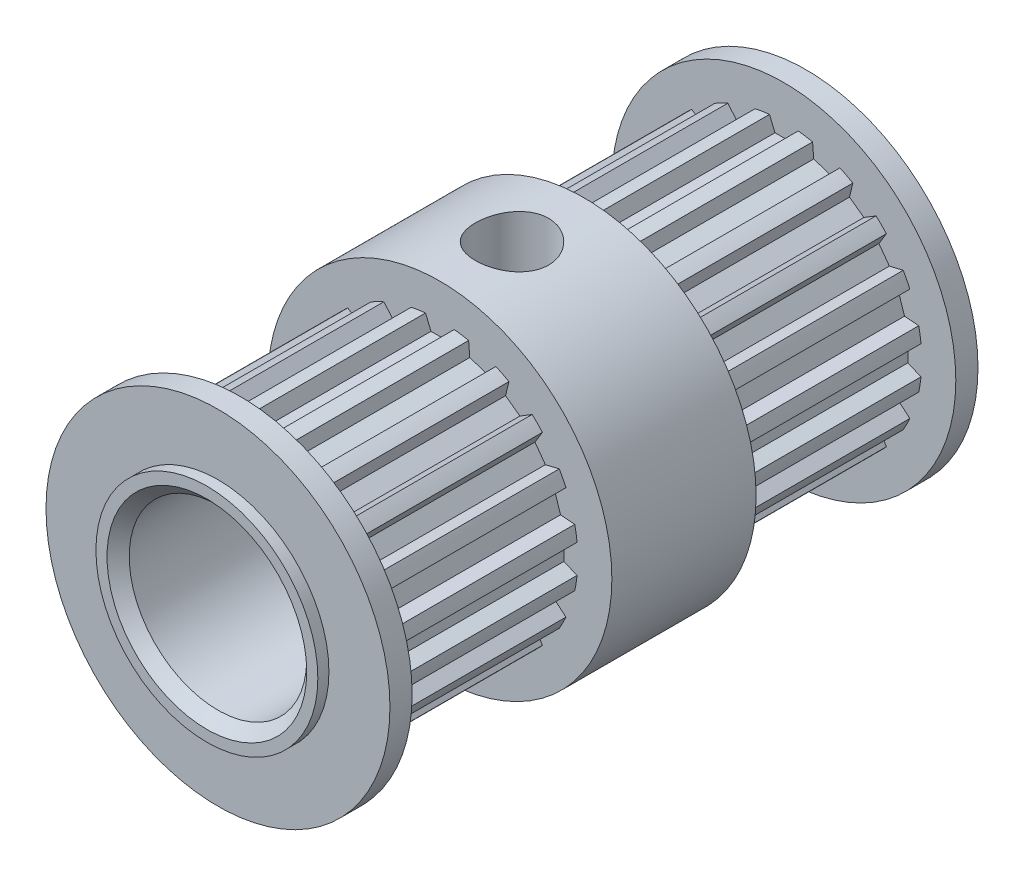
from build123d import *

# Parameters (mm, degrees)
SALIENTE_EXTRUIR1_DEPTH             = 9
CROQUIS2_R                          = 7.75
SALIENTE_EXTRUIR2_DEPTH             = 1
SALIENTE_EXTRUIR3_START             = -6.5
CROQUIS3_R                          = 7.75
SALIENTE_EXTRUIR3_DEPTH             = 6.5
SALIENTE_EXTRUIR4_START             = 9
SALIENTE_EXTRUIR4_DEPTH             = 9
SALIENTE_EXTRUIR5_START             = -1
CROQUIS5_R                          = 7.75
SALIENTE_EXTRUIR5_DEPTH             = 1
CROQUIS6_R                          = 5
SALIENTE_EXTRUIR6_DEPTH             = 0.5
SALIENTE_EXTRUIR7_START             = 0.5
CROQUIS7_R                          = 5
SALIENTE_EXTRUIR7_DEPTH             = 0.5
DI_METRO_DE_TALADRO_8_0_8_1_D       = 8
TALADRO_DE_MARGEN_PARA_M3_51_REACH  = 24.122
TALADRO_DE_MARGEN_PARA_M3_51_BORE_R = 1.65
CHAFL_N1_SIZE                       = 0.5


with BuildPart() as part:
    # Croquis1 → Saliente-Extruir1 (new body)
    with BuildSketch(Plane(origin=(0, 0, 6.5), x_dir=(-1, 0, 0), z_dir=(0, 0, -1))):
        with BuildLine():
            Line((-0.64608076, -6.181327095), (-0.4, -5.587235585))
            Line((-0.4, -5.587235585), (0.4, -5.587235585))
            Line((0.4, -5.587235585), (0.64608076, -6.181327095))
            ThreePointArc((0.64608076, -6.181327095), (0.9722402, -6.138483037), (1.295675803, -6.078441347))
            Line((1.295675803, -6.078441347), (1.346128141, -5.437383609))
            Line((1.346128141, -5.437383609), (2.106973354, -5.190170014))
            Line((2.106973354, -5.190170014), (2.524594437, -5.679141478))
            ThreePointArc((2.524594437, -5.679141478), (2.821550956, -5.537605548), (3.110602591, -5.38055541))
            Line((3.110602591, -5.38055541), (2.96048788, -4.755282641))
            Line((2.96048788, -4.755282641), (3.607701476, -4.285054439))
            Line((3.607701476, -4.285054439), (4.155983221, -4.621041925))
            ThreePointArc((4.155983221, -4.621041925), (4.394668645, -4.394668645), (4.621041925, -4.155983221))
            Line((4.621041925, -4.155983221), (4.285054439, -3.607701476))
            Line((4.285054439, -3.607701476), (4.755282641, -2.96048788))
            Line((4.755282641, -2.96048788), (5.38055541, -3.110602591))
            ThreePointArc((5.38055541, -3.110602591), (5.537605548, -2.821550956), (5.679141478, -2.524594437))
            Line((5.679141478, -2.524594437), (5.190170014, -2.106973354))
            Line((5.190170014, -2.106973354), (5.437383609, -1.346128141))
            Line((5.437383609, -1.346128141), (6.078441347, -1.295675803))
            ThreePointArc((6.078441347, -1.295675803), (6.138483037, -0.9722402), (6.181327095, -0.64608076))
            Line((6.181327095, -0.64608076), (5.587235585, -0.4))
            Line((5.587235585, -0.4), (5.587235585, 0.4))
            Line((5.587235585, 0.4), (6.181327095, 0.64608076))
            ThreePointArc((6.181327095, 0.64608076), (6.138483037, 0.9722402), (6.078441347, 1.295675803))
            Line((6.078441347, 1.295675803), (5.437383609, 1.346128141))
            Line((5.437383609, 1.346128141), (5.190170014, 2.106973354))
            Line((5.190170014, 2.106973354), (5.679141478, 2.524594437))
            ThreePointArc((5.679141478, 2.524594437), (5.537605548, 2.821550956), (5.38055541, 3.110602591))
            Line((5.38055541, 3.110602591), (4.755282641, 2.96048788))
            Line((4.755282641, 2.96048788), (4.285054439, 3.607701476))
            Line((4.285054439, 3.607701476), (4.621041925, 4.155983221))
            ThreePointArc((4.621041925, 4.155983221), (4.394668645, 4.394668645), (4.155983221, 4.621041925))
            Line((4.155983221, 4.621041925), (3.607701476, 4.285054439))
            Line((3.607701476, 4.285054439), (2.96048788, 4.755282641))
            Line((2.96048788, 4.755282641), (3.110602591, 5.38055541))
            ThreePointArc((3.110602591, 5.38055541), (2.821550956, 5.537605548), (2.524594437, 5.679141478))
            Line((2.524594437, 5.679141478), (2.106973354, 5.190170014))
            Line((2.106973354, 5.190170014), (1.346128141, 5.437383609))
            Line((1.346128141, 5.437383609), (1.295675803, 6.078441347))
            ThreePointArc((1.295675803, 6.078441347), (0.9722402, 6.138483037), (0.64608076, 6.181327095))
            Line((0.64608076, 6.181327095), (0.4, 5.587235585))
            Line((0.4, 5.587235585), (-0.4, 5.587235585))
            Line((-0.4, 5.587235585), (-0.64608076, 6.181327095))
            ThreePointArc((-0.64608076, 6.181327095), (-0.9722402, 6.138483037), (-1.295675803, 6.078441347))
            Line((-1.295675803, 6.078441347), (-1.346128141, 5.437383609))
            Line((-1.346128141, 5.437383609), (-2.106973354, 5.190170014))
            Line((-2.106973354, 5.190170014), (-2.524594437, 5.679141478))
            ThreePointArc((-2.524594437, 5.679141478), (-2.821550956, 5.537605548), (-3.110602591, 5.38055541))
            Line((-3.110602591, 5.38055541), (-2.96048788, 4.755282641))
            Line((-2.96048788, 4.755282641), (-3.607701476, 4.285054439))
            Line((-3.607701476, 4.285054439), (-4.155983221, 4.621041925))
            ThreePointArc((-4.155983221, 4.621041925), (-4.394668645, 4.394668645), (-4.621041925, 4.155983221))
            Line((-4.621041925, 4.155983221), (-4.285054439, 3.607701476))
            Line((-4.285054439, 3.607701476), (-4.755282641, 2.96048788))
            Line((-4.755282641, 2.96048788), (-5.38055541, 3.110602591))
            ThreePointArc((-5.38055541, 3.110602591), (-5.537605548, 2.821550956), (-5.679141478, 2.524594437))
            Line((-5.679141478, 2.524594437), (-5.190170014, 2.106973354))
            Line((-5.190170014, 2.106973354), (-5.437383609, 1.346128141))
            Line((-5.437383609, 1.346128141), (-6.078441347, 1.295675803))
            ThreePointArc((-6.078441347, 1.295675803), (-6.138483037, 0.9722402), (-6.181327095, 0.64608076))
            Line((-6.181327095, 0.64608076), (-5.587235585, 0.4))
            Line((-5.587235585, 0.4), (-5.587235585, -0.4))
            Line((-5.587235585, -0.4), (-6.181327095, -0.64608076))
            ThreePointArc((-6.181327095, -0.64608076), (-6.138483037, -0.9722402), (-6.078441347, -1.295675803))
            Line((-6.078441347, -1.295675803), (-5.437383609, -1.346128141))
            Line((-5.437383609, -1.346128141), (-5.190170014, -2.106973354))
            Line((-5.190170014, -2.106973354), (-5.679141478, -2.524594437))
            ThreePointArc((-5.679141478, -2.524594437), (-5.537605548, -2.821550956), (-5.38055541, -3.110602591))
            Line((-5.38055541, -3.110602591), (-4.755282641, -2.96048788))
            Line((-4.755282641, -2.96048788), (-4.285054439, -3.607701476))
            Line((-4.285054439, -3.607701476), (-4.621041925, -4.155983221))
            ThreePointArc((-4.621041925, -4.155983221), (-4.394668645, -4.394668645), (-4.155983221, -4.621041925))
            Line((-4.155983221, -4.621041925), (-3.607701476, -4.285054439))
            Line((-3.607701476, -4.285054439), (-2.96048788, -4.755282641))
            Line((-2.96048788, -4.755282641), (-3.110602591, -5.38055541))
            ThreePointArc((-3.110602591, -5.38055541), (-2.821550956, -5.537605548), (-2.524594437, -5.679141478))
            Line((-2.524594437, -5.679141478), (-2.106973354, -5.190170014))
            Line((-2.106973354, -5.190170014), (-1.346128141, -5.437383609))
            Line((-1.346128141, -5.437383609), (-1.295675803, -6.078441347))
            ThreePointArc((-1.295675803, -6.078441347), (-0.9722402, -6.138483037), (-0.64608076, -6.181327095))
        make_face()
    extrude(amount=-SALIENTE_EXTRUIR1_DEPTH)

    # Croquis2 → Saliente-Extruir2 (add)
    with BuildSketch(Plane(origin=(0, 0, 15.5), x_dir=(-1, 0, 0), z_dir=(0, 0, -1))):
        with Locations(Location((0, 0, 0), (0, 0, 180))):
            Circle(CROQUIS2_R)
    extrude(amount=-SALIENTE_EXTRUIR2_DEPTH)

    # Croquis3 → Saliente-Extruir3 (add)
    with BuildSketch(Plane.XY.offset(6.5).offset(SALIENTE_EXTRUIR3_START)):
        Circle(CROQUIS3_R)
    extrude(amount=SALIENTE_EXTRUIR3_DEPTH)

    # Croquis4 → Saliente-Extruir4 (add)
    with BuildSketch(Plane(origin=(0, 0, 0), x_dir=(-1, 0, 0), z_dir=(0, 0, -1)).offset(SALIENTE_EXTRUIR4_START)):
        with BuildLine():
            Line((-5.190170014, 2.106973354), (-5.679141478, 2.524594437))
            ThreePointArc((-5.679141478, 2.524594437), (-5.537605548, 2.821550956), (-5.38055541, 3.110602591))
            Line((-5.38055541, 3.110602591), (-4.755282641, 2.96048788))
            Line((-4.755282641, 2.96048788), (-4.285054439, 3.607701476))
            Line((-4.285054439, 3.607701476), (-4.621041925, 4.155983221))
            ThreePointArc((-4.621041925, 4.155983221), (-4.394668645, 4.394668645), (-4.155983221, 4.621041925))
            Line((-4.155983221, 4.621041925), (-3.607701476, 4.285054439))
            Line((-3.607701476, 4.285054439), (-2.96048788, 4.755282641))
            Line((-2.96048788, 4.755282641), (-3.110602591, 5.38055541))
            ThreePointArc((-3.110602591, 5.38055541), (-2.821550956, 5.537605548), (-2.524594437, 5.679141478))
            Line((-2.524594437, 5.679141478), (-2.106973354, 5.190170014))
            Line((-2.106973354, 5.190170014), (-1.346128141, 5.437383609))
            Line((-1.346128141, 5.437383609), (-1.295675803, 6.078441347))
            ThreePointArc((-1.295675803, 6.078441347), (-0.9722402, 6.138483037), (-0.64608076, 6.181327095))
            Line((-0.64608076, 6.181327095), (-0.4, 5.587235585))
            Line((-0.4, 5.587235585), (0.4, 5.587235585))
            Line((0.4, 5.587235585), (0.64608076, 6.181327095))
            ThreePointArc((0.64608076, 6.181327095), (0.9722402, 6.138483037), (1.295675803, 6.078441347))
            Line((1.295675803, 6.078441347), (1.346128141, 5.437383609))
            Line((1.346128141, 5.437383609), (2.106973354, 5.190170014))
            Line((2.106973354, 5.190170014), (2.524594437, 5.679141478))
            ThreePointArc((2.524594437, 5.679141478), (2.821550956, 5.537605548), (3.110602591, 5.38055541))
            Line((3.110602591, 5.38055541), (2.96048788, 4.755282641))
            Line((2.96048788, 4.755282641), (3.607701476, 4.285054439))
            Line((3.607701476, 4.285054439), (4.155983221, 4.621041925))
            ThreePointArc((4.155983221, 4.621041925), (4.394668645, 4.394668645), (4.621041925, 4.155983221))
            Line((4.621041925, 4.155983221), (4.285054439, 3.607701476))
            Line((4.285054439, 3.607701476), (4.755282641, 2.96048788))
            Line((4.755282641, 2.96048788), (5.38055541, 3.110602591))
            ThreePointArc((5.38055541, 3.110602591), (5.537605548, 2.821550956), (5.679141478, 2.524594437))
            Line((5.679141478, 2.524594437), (5.190170014, 2.106973354))
            Line((5.190170014, 2.106973354), (5.437383609, 1.346128141))
            Line((5.437383609, 1.346128141), (6.078441347, 1.295675803))
            ThreePointArc((6.078441347, 1.295675803), (6.138483037, 0.9722402), (6.181327095, 0.64608076))
            Line((6.181327095, 0.64608076), (5.587235585, 0.4))
            Line((5.587235585, 0.4), (5.587235585, -0.4))
            Line((5.587235585, -0.4), (6.181327095, -0.64608076))
            ThreePointArc((6.181327095, -0.64608076), (6.138483037, -0.9722402), (6.078441347, -1.295675803))
            Line((6.078441347, -1.295675803), (5.437383609, -1.346128141))
            Line((5.437383609, -1.346128141), (5.190170014, -2.106973354))
            Line((5.190170014, -2.106973354), (5.679141478, -2.524594437))
            ThreePointArc((5.679141478, -2.524594437), (5.537605548, -2.821550956), (5.38055541, -3.110602591))
            Line((5.38055541, -3.110602591), (4.755282641, -2.96048788))
            Line((4.755282641, -2.96048788), (4.285054439, -3.607701476))
            Line((4.285054439, -3.607701476), (4.621041925, -4.155983221))
            ThreePointArc((4.621041925, -4.155983221), (4.394668645, -4.394668645), (4.155983221, -4.621041925))
            Line((4.155983221, -4.621041925), (3.607701476, -4.285054439))
            Line((3.607701476, -4.285054439), (2.96048788, -4.755282641))
            Line((2.96048788, -4.755282641), (3.110602591, -5.38055541))
            ThreePointArc((3.110602591, -5.38055541), (2.821550956, -5.537605548), (2.524594437, -5.679141478))
            Line((2.524594437, -5.679141478), (2.106973354, -5.190170014))
            Line((2.106973354, -5.190170014), (1.346128141, -5.437383609))
            Line((1.346128141, -5.437383609), (1.295675803, -6.078441347))
            ThreePointArc((1.295675803, -6.078441347), (0.9722402, -6.138483037), (0.64608076, -6.181327095))
            Line((0.64608076, -6.181327095), (0.4, -5.587235585))
            Line((0.4, -5.587235585), (-0.4, -5.587235585))
            Line((-0.4, -5.587235585), (-0.64608076, -6.181327095))
            ThreePointArc((-0.64608076, -6.181327095), (-0.9722402, -6.138483037), (-1.295675803, -6.078441347))
            Line((-1.295675803, -6.078441347), (-1.346128141, -5.437383609))
            Line((-1.346128141, -5.437383609), (-2.106973354, -5.190170014))
            Line((-2.106973354, -5.190170014), (-2.524594437, -5.679141478))
            ThreePointArc((-2.524594437, -5.679141478), (-2.821550956, -5.537605548), (-3.110602591, -5.38055541))
            Line((-3.110602591, -5.38055541), (-2.96048788, -4.755282641))
            Line((-2.96048788, -4.755282641), (-3.607701476, -4.285054439))
            Line((-3.607701476, -4.285054439), (-4.155983221, -4.621041925))
            ThreePointArc((-4.155983221, -4.621041925), (-4.394668645, -4.394668645), (-4.621041925, -4.155983221))
            Line((-4.621041925, -4.155983221), (-4.285054439, -3.607701476))
            Line((-4.285054439, -3.607701476), (-4.755282641, -2.96048788))
            Line((-4.755282641, -2.96048788), (-5.38055541, -3.110602591))
            ThreePointArc((-5.38055541, -3.110602591), (-5.537605548, -2.821550956), (-5.679141478, -2.524594437))
            Line((-5.679141478, -2.524594437), (-5.190170014, -2.106973354))
            Line((-5.190170014, -2.106973354), (-5.437383609, -1.346128141))
            Line((-5.437383609, -1.346128141), (-6.078441347, -1.295675803))
            ThreePointArc((-6.078441347, -1.295675803), (-6.138483037, -0.9722402), (-6.181327095, -0.64608076))
            Line((-6.181327095, -0.64608076), (-5.587235585, -0.4))
            Line((-5.587235585, -0.4), (-5.587235585, 0.4))
            Line((-5.587235585, 0.4), (-6.181327095, 0.64608076))
            ThreePointArc((-6.181327095, 0.64608076), (-6.138483037, 0.9722402), (-6.078441347, 1.295675803))
            Line((-6.078441347, 1.295675803), (-5.437383609, 1.346128141))
            Line((-5.437383609, 1.346128141), (-5.190170014, 2.106973354))
        make_face()
    extrude(amount=-SALIENTE_EXTRUIR4_DEPTH)

    # Croquis5 → Saliente-Extruir5 (add)
    with BuildSketch(Plane.XY.offset(-9).offset(SALIENTE_EXTRUIR5_START)):
        Circle(CROQUIS5_R)
    extrude(amount=SALIENTE_EXTRUIR5_DEPTH)

    # Croquis6 → Saliente-Extruir6 (add)
    with BuildSketch(Plane.XY.offset(16.5)):
        Circle(CROQUIS6_R)
    extrude(amount=SALIENTE_EXTRUIR6_DEPTH)

    # Croquis7 → Saliente-Extruir7 (add)
    with BuildSketch(Plane(origin=(0, 0, -10), x_dir=(-1, 0, 0), z_dir=(0, 0, -1)).offset(SALIENTE_EXTRUIR7_START)):
        with Locations(Location((0, 0, 0), (0, 0, 180))):
            Circle(CROQUIS7_R)
    extrude(amount=-SALIENTE_EXTRUIR7_DEPTH)

    # Diámetro de taladro Ø8.0 (8)1 (through all)
    with Locations(Plane.XY.offset(17)):
        with Locations((0, 0)):
            Hole(DI_METRO_DE_TALADRO_8_0_8_1_D / 2)

    # Taladro de margen para M3.51 bore (on position points) → Taladro de margen para M3.51 (cut, up to next)
    with BuildSketch(Plane(origin=(0, 7.75, 3.25), x_dir=(1, 0, 0), z_dir=(0, 1, 0)), mode=Mode.PRIVATE) as taladro_de_margen_para_m3_51_sk1:
        Circle(TALADRO_DE_MARGEN_PARA_M3_51_BORE_R)
    taladro_de_margen_para_m3_51_tool1 = extrude(taladro_de_margen_para_m3_51_sk1.sketch, amount=-TALADRO_DE_MARGEN_PARA_M3_51_REACH, mode=Mode.PRIVATE) & part.part
    add(taladro_de_margen_para_m3_51_tool1.solids().sort_by_distance((0, 7.75, 3.25))[0], mode=Mode.SUBTRACT)

    # Chaflán1
    chafl_n1_edges = [part.edges().sort_by_distance(p)[0] for p in [
        (4, 0, 17),
        (4, 0, -10.5),
    ]]
    chamfer(chafl_n1_edges, length=CHAFL_N1_SIZE)


solid = part.part
